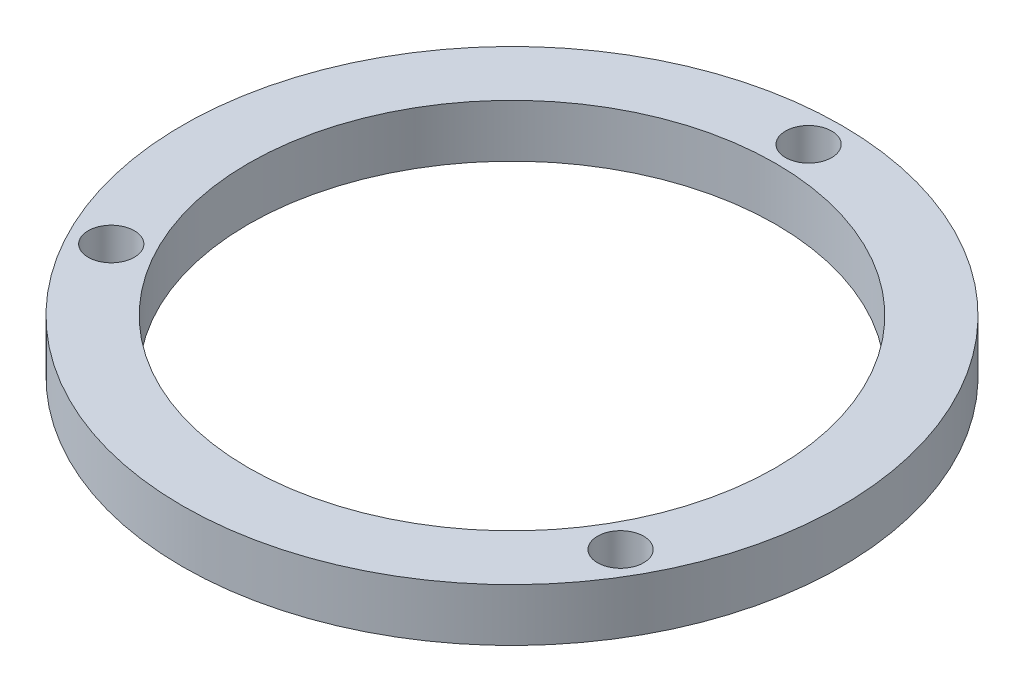
from build123d import *

# Parameters (mm, degrees)
SKIZZE2_R                       = 50
SKIZZE2_R_2                     = 2
AUFSATZ_LINEAR_AUSTRAGEN1_DEPTH = 8
SCHNITT_LINEAR_AUSTRAGEN2_DEPTH = 3
SKIZZE39_R                      = 40
SCHNITT_LINEAR_AUSTRAGEN3_DEPTH = 10
SKIZZE10_R                      = 3.5
SCHNITT_LINEAR_AUSTRAGEN4_DEPTH = 10


with BuildPart() as part:
    # Skizze2 → Aufsatz-Linear austragen1 (new body)
    with BuildSketch(Plane(origin=(0, 0, 0), x_dir=(1, 0, 0), z_dir=(0, 1, 0))):
        with Locations(Location((0, 0, 0), (0, 0, 270))):
            Circle(SKIZZE2_R)
        with Locations(Location((38.97114317, -22.5, 0), (0, 0, 270))):
            Circle(SKIZZE2_R_2, mode=Mode.SUBTRACT)
        with Locations(Location((-39.80150929, -20.996186754, 0), (0, 0, 270))):
            Circle(SKIZZE2_R_2, mode=Mode.SUBTRACT)
        with Locations(Location((0, 45, 0), (0, 0, 270))):
            Circle(SKIZZE2_R_2, mode=Mode.SUBTRACT)
        with Locations(Location((0, -35, 0), (0, 0, 270))):
            Circle(SKIZZE2_R_2, mode=Mode.SUBTRACT)
        with Locations(Location((0, -27.5, 0), (0, 0, 270))):
            Circle(SKIZZE2_R_2, mode=Mode.SUBTRACT)
    extrude(amount=AUFSATZ_LINEAR_AUSTRAGEN1_DEPTH)

    # Skizze9 → Schnitt-Linear austragen2 (cut)
    with BuildSketch(Plane(origin=(0, 8, 0), x_dir=(1, 0, 0), z_dir=(0, 1, 0))):
        with BuildLine():
            Line((-6, -39.531216002), (-6, -22.531216002))
            Line((-6, -22.531216002), (6, -22.531216002))
            Line((6, -22.531216002), (6, -39.531216002))
            ThreePointArc((6, -39.531216002), (0, 39.983959767), (-6, -39.531216002))
        make_face()
    extrude(amount=-SCHNITT_LINEAR_AUSTRAGEN2_DEPTH, mode=Mode.SUBTRACT)

    # Skizze39 → Schnitt-Linear austragen3 (cut)
    with BuildSketch(Plane(origin=(0, 0, 0), x_dir=(-1, 0, 0), z_dir=(0, -1, 0))):
        with Locations(Location((0, 0, 0), (0, 0, 90))):
            Circle(SKIZZE39_R)
    extrude(amount=-SCHNITT_LINEAR_AUSTRAGEN3_DEPTH, mode=Mode.SUBTRACT)

    # Skizze10 → Schnitt-Linear austragen4 (cut)
    with BuildSketch(Plane.XZ):
        with Locations(Location((38.97114317, 22.5, 0), (0, 0, 270))):
            Circle(SKIZZE10_R)
        with Locations(Location((-39.80150929, 20.996186754, 0), (0, 0, 270))):
            Circle(SKIZZE10_R)
        with Locations(Location((0, -45, 0), (0, 0, 270))):
            Circle(SKIZZE10_R)
    extrude(amount=-SCHNITT_LINEAR_AUSTRAGEN4_DEPTH, mode=Mode.SUBTRACT)


solid = part.part
